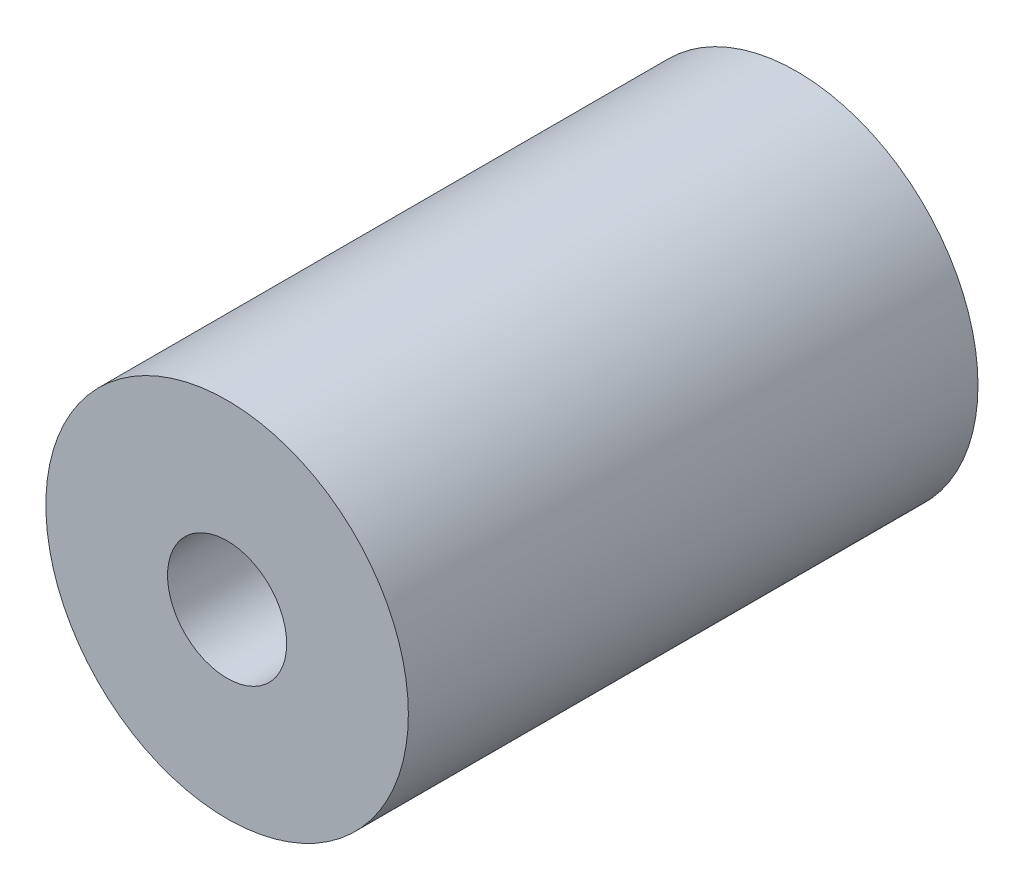
from build123d import *

# Parameters (mm, degrees)
CROQUIS1_R              = 3.5
SALIENTE_EXTRUIR1_DEPTH = 11
CORTAR_EXTRUIR1_DEPTH   = 7
CROQUIS4_R              = 1.15
CORTAR_EXTRUIR2_DEPTH   = 2.3


with BuildPart() as part:
    # Croquis1 → Saliente-Extruir1 (new body)
    with BuildSketch(Plane.XY):
        Circle(CROQUIS1_R)
    extrude(amount=SALIENTE_EXTRUIR1_DEPTH)

    # Croquis3 → Cortar-Extruir1 (cut)
    with BuildSketch(Plane(origin=(0, 0, 0), x_dir=(-1, 0, 0), z_dir=(0, 0, -1))):
        Polygon((1.549659556, 2.684875278), (-1.550340419, 2.684482182), (-3.099999975, -0.000393096), (-1.549659556, -2.684875278), (1.550340419, -2.684482182), (3.099999975, 0.000393096), align=None)
    extrude(amount=-CORTAR_EXTRUIR1_DEPTH, mode=Mode.SUBTRACT)

    # Croquis4 → Cortar-Extruir2 (cut)
    with BuildSketch(Plane.XY.offset(11)):
        Circle(CROQUIS4_R)
    extrude(amount=-CORTAR_EXTRUIR2_DEPTH, mode=Mode.SUBTRACT)


solid = part.part
